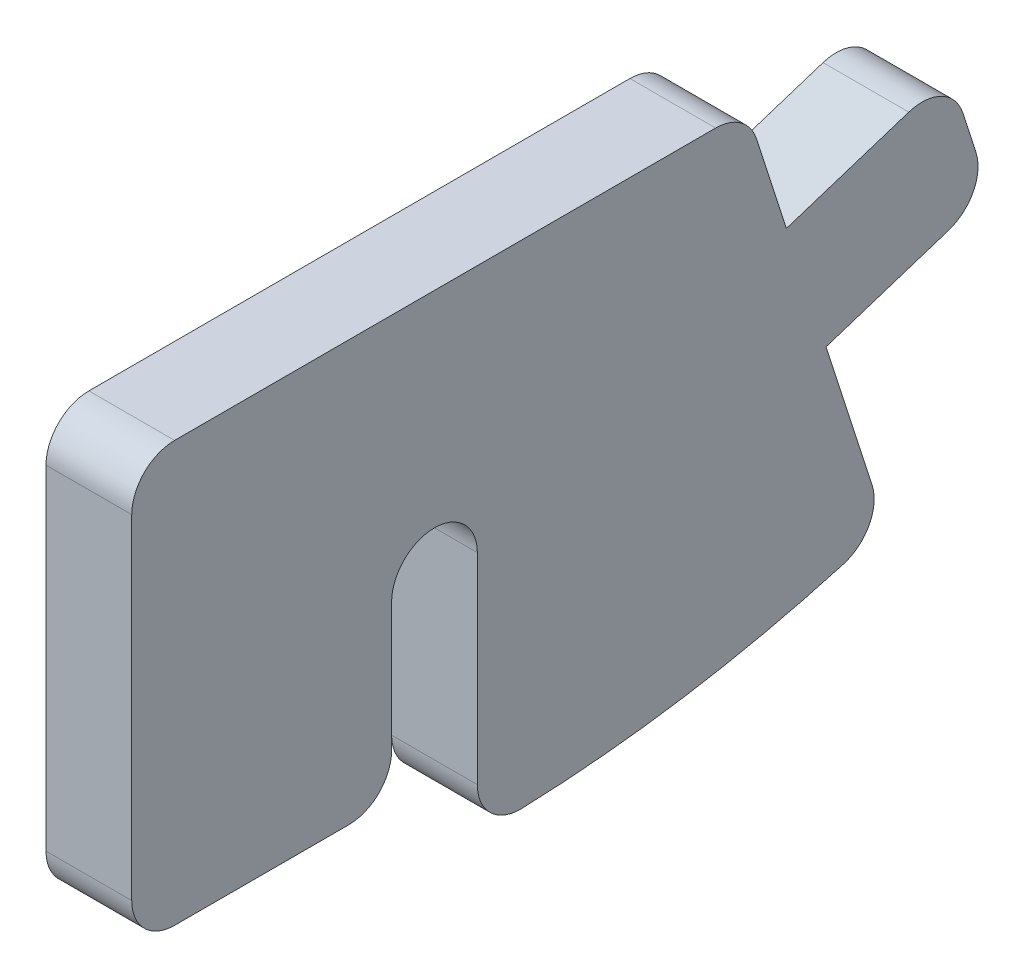
from build123d import *

# Parameters (mm, degrees)
RESSALTO_EXTRUS_O1_DEPTH = 2


with BuildPart() as part:
    # Esboço1 → Ressalto-extrusão1 (new body)
    with BuildSketch(Plane(origin=(0, 0, 0), x_dir=(0, 0, -1), z_dir=(1, 0, 0))):
        with BuildLine():
            Line((1, 0), (13.619955174, 0))
            ThreePointArc((13.619955174, 0), (14.20826651, -0.191365489), (14.571412872, -0.692220455))
            Line((14.571412872, -0.692220455), (15.270830572, -2.854373095))
            Line((15.270830572, -2.854373095), (18.125203668, -1.931034461))
            ThreePointArc((18.125203668, -1.931034461), (18.8881324, -1.992076966), (19.384440911, -2.574712615))
            Line((19.384440911, -2.574712615), (19.692220455, -3.526170314))
            ThreePointArc((19.692220455, -3.526170314), (19.631177951, -4.289099046), (19.048542302, -4.785407557))
            Line((19.048542302, -4.785407557), (16.194169206, -5.708746191))
            Line((16.194169206, -5.708746191), (17.269391177, -9.032645519))
            ThreePointArc((17.269391177, -9.032645519), (17.200620929, -9.810385556), (16.593756544, -10.301633488))
            ThreePointArc((16.593756544, -10.301633488), (12.880660395, -11.123916543), (9.094724575, -11.484364042))
            ThreePointArc((9.094724575, -11.484364042), (8.366122719, -11.203742859), (8.061318263, -10.484922189))
            Line((8.061318263, -10.484922189), (8.061318263, -5.79672436))
            ThreePointArc((8.061318263, -5.79672436), (7.061318263, -4.79672436), (6.061318263, -5.79672436))
            Line((6.061318263, -5.79672436), (6.061318263, -8.79672436))
            ThreePointArc((6.061318263, -8.79672436), (5.768425044, -9.503831141), (5.061318263, -9.79672436))
            Line((5.061318263, -9.79672436), (1, -9.79672436))
            ThreePointArc((1, -9.79672436), (0.292893219, -9.503831141), (0, -8.79672436))
            Line((0, -8.79672436), (0, -1))
            ThreePointArc((0, -1), (0.292893219, -0.292893219), (1, 0))
        make_face()
    extrude(amount=RESSALTO_EXTRUS_O1_DEPTH)


solid = part.part
